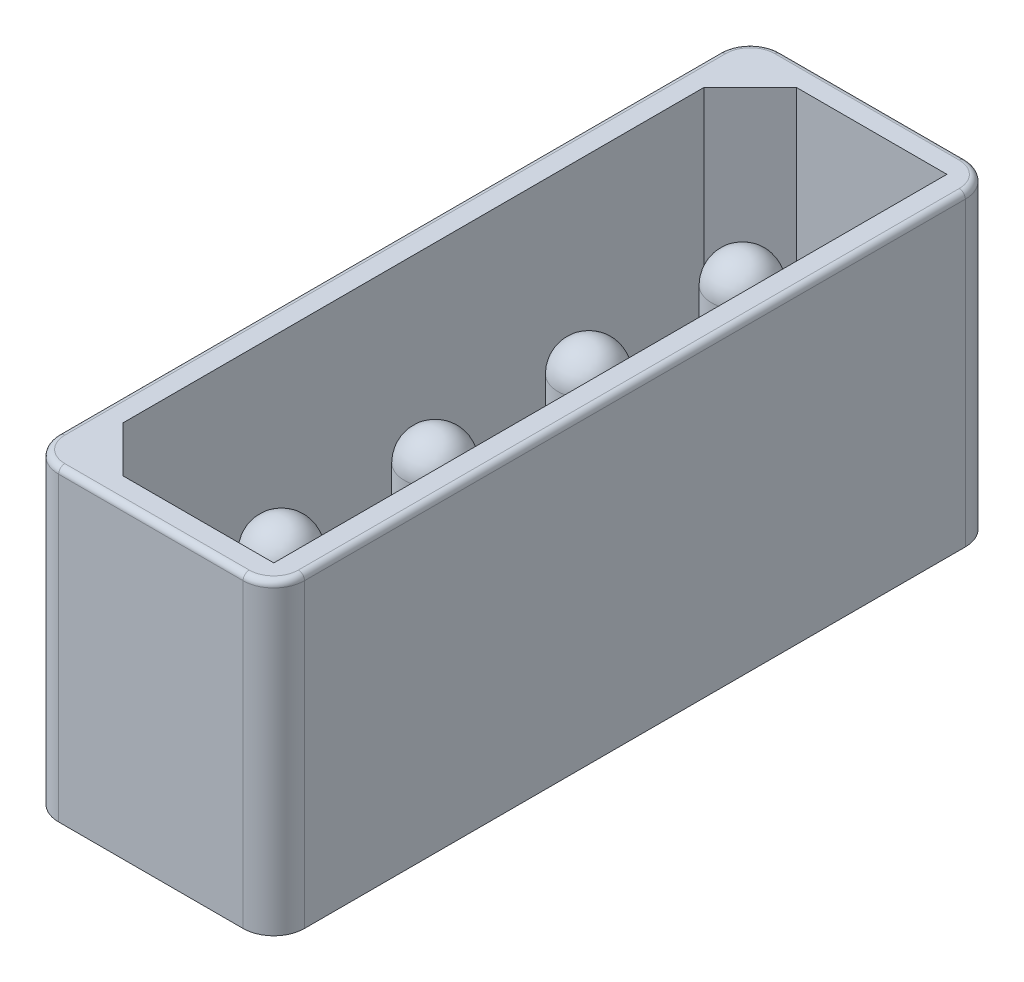
from build123d import *

# Parameters (mm, degrees)
CROQUIS1_W            = 8
CROQUIS1_H            = 23.5
CROQUIS1_W_2          = 6.4
CROQUIS1_H_2          = 21.9
EXTRUIR1_DEPTH        = 11
CHAFL_N1_SIZE         = 1.5
REDONDEO1_R           = 1
REDONDEO2_R           = 0.2
EXTRUIR2_START        = -1
EXTRUIR2_DEPTH        = 1
CROQUIS3_R            = 1
EXTRUIR4_DEPTH        = 8
EXTRUIR4_2_DEPTH      = 8
EXTRUIR4_3_DEPTH      = 8
EXTRUIR4_4_DEPTH      = 8
REDONDEO3_R           = 1
REDONDEO4_R           = 1
REDONDEO5_R           = 1
REDONDEO6_R           = 1
CROQUIS4_W            = 24.783427495
CROQUIS4_H            = 1.401443817
CORTAR_EXTRUIR1_DEPTH = 14
EXTRUIR5_DEPTH        = 0.5


with BuildPart() as part:
    # Croquis1 → Extruir1 (new body)
    with BuildSketch(Plane(origin=(0, 0, 0), x_dir=(1, 0, 0), z_dir=(0, 1, 0))):
        Rectangle(CROQUIS1_W, CROQUIS1_H)
        Rectangle(CROQUIS1_W_2, CROQUIS1_H_2, mode=Mode.SUBTRACT)
    extrude(amount=EXTRUIR1_DEPTH)

    # Chaflán1
    chafl_n1_edges = [part.edges().sort_by_distance(p)[0] for p in [
        (-3.2, 5.5, 10.95),
        (-3.2, 5.5, -10.95),
    ]]
    chamfer(chafl_n1_edges, length=CHAFL_N1_SIZE)

    # Redondeo1
    redondeo1_edges = [part.edges().sort_by_distance(p)[0] for p in [
        (-4, 5.5, 11.75),
        (4, 5.5, 11.75),
        (4, 5.5, -11.75),
        (-4, 5.5, -11.75),
    ]]
    fillet(redondeo1_edges, radius=REDONDEO1_R)

    # Redondeo2
    redondeo2_edges = [part.edges().sort_by_distance(p)[0] for p in [
        (-3.707106781, 11, 11.457106781),
        (-4, 11, 0),
        (-3.707106781, 11, -11.457106781),
        (0, 11, -11.75),
        (3.707106781, 11, -11.457106781),
        (4, 11, 0),
        (3.707106781, 11, 11.457106781),
        (0, 11, 11.75),
    ]]
    fillet(redondeo2_edges, radius=REDONDEO2_R)

    # Croquis2 → Extruir2 (add)
    with BuildSketch(Plane.XZ.offset(EXTRUIR2_START)):
        with BuildLine():
            Line((3, 11.75), (-3, 11.75))
            ThreePointArc((-3, 11.75), (-3.707106781, 11.457106781), (-4, 10.75))
            Line((-4, 10.75), (-4, -10.75))
            ThreePointArc((-4, -10.75), (-3.707106781, -11.457106781), (-3, -11.75))
            Line((-3, -11.75), (3, -11.75))
            ThreePointArc((3, -11.75), (3.707106781, -11.457106781), (4, -10.75))
            Line((4, -10.75), (4, 10.75))
            ThreePointArc((4, 10.75), (3.707106781, 11.457106781), (3, 11.75))
        make_face()
    extrude(amount=EXTRUIR2_DEPTH)

    # Croquis4 → Cortar-Extruir1 (cut)
    with BuildSketch(Plane.ZY.offset(4)):
        with Locations((-0.0368801, 0.299278091)):
            Rectangle(CROQUIS4_W, CROQUIS4_H)
    extrude(amount=-CORTAR_EXTRUIR1_DEPTH, mode=Mode.SUBTRACT)


with BuildPart() as body_2:
    # Croquis3 → Extruir4 (new body)
    with BuildSketch(Plane(origin=(0, 1, 0), x_dir=(-1, 0, 0), z_dir=(0, 1, 0))):
        with Locations((0, 7.5)):
            Circle(CROQUIS3_R)
    extrude(amount=EXTRUIR4_DEPTH)

    # Redondeo6
    redondeo6_edges = [body_2.edges().sort_by_distance(p)[0] for p in [
        (1, 9, 7.5),
    ]]
    fillet(redondeo6_edges, radius=REDONDEO6_R)


with BuildPart() as body_3:
    # Croquis3 → Extruir4 2 (new body)
    with BuildSketch(Plane(origin=(0, 1, 0), x_dir=(-1, 0, 0), z_dir=(0, 1, 0))):
        with Locations((0, 2.5)):
            Circle(CROQUIS3_R)
    extrude(amount=EXTRUIR4_2_DEPTH)

    # Redondeo5
    redondeo5_edges = [body_3.edges().sort_by_distance(p)[0] for p in [
        (1, 9, 2.5),
    ]]
    fillet(redondeo5_edges, radius=REDONDEO5_R)


with BuildPart() as body_4:
    # Croquis3 → Extruir4 3 (new body)
    with BuildSketch(Plane(origin=(0, 1, 0), x_dir=(-1, 0, 0), z_dir=(0, 1, 0))):
        with Locations((0, -2.5)):
            Circle(CROQUIS3_R)
    extrude(amount=EXTRUIR4_3_DEPTH)

    # Redondeo4
    redondeo4_edges = [body_4.edges().sort_by_distance(p)[0] for p in [
        (1, 9, -2.5),
    ]]
    fillet(redondeo4_edges, radius=REDONDEO4_R)


with BuildPart() as body_5:
    # Croquis3 → Extruir4 4 (new body)
    with BuildSketch(Plane(origin=(0, 1, 0), x_dir=(-1, 0, 0), z_dir=(0, 1, 0))):
        with Locations((0, -7.5)):
            Circle(CROQUIS3_R)
    extrude(amount=EXTRUIR4_4_DEPTH)

    # Redondeo3
    redondeo3_edges = [body_5.edges().sort_by_distance(p)[0] for p in [
        (1, 9, -7.5),
    ]]
    fillet(redondeo3_edges, radius=REDONDEO3_R)


with BuildPart() as body_6:
    # Croquis5 → Extruir5 (new body)
    with BuildSketch(Plane.XZ.offset(-1)):
        with BuildLine():
            Line((-4, 10.75), (-4, -10.75))
            ThreePointArc((-4, -10.75), (-3.707106781, -11.457106781), (-3, -11.75))
            Line((-3, -11.75), (3, -11.75))
            ThreePointArc((3, -11.75), (3.707106781, -11.457106781), (4, -10.75))
            Line((4, -10.75), (4, 10.75))
            ThreePointArc((4, 10.75), (3.707106781, 11.457106781), (3, 11.75))
            Line((3, 11.75), (-3, 11.75))
            ThreePointArc((-3, 11.75), (-3.707106781, 11.457106781), (-4, 10.75))
        make_face()
    extrude(amount=-EXTRUIR5_DEPTH)

    # Combinar1: union part
    add(part.part)


solid = Compound([body_2.part, body_3.part, body_4.part, body_5.part, body_6.part])
